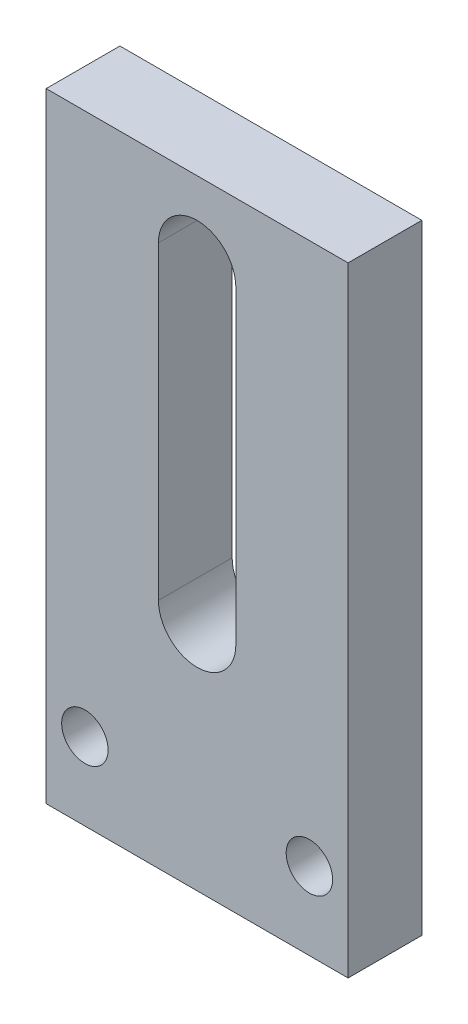
from build123d import *

# Parameters (mm, degrees)
SKETCH1_4_W         = 19.5
SKETCH1_4_H         = 40
SKETCH1_4_R         = 1.5
BOSS_EXTRUDE3_DEPTH = 4.7625


with BuildPart() as part:
    # Sketch1<4> → Boss-Extrude3 (new body)
    with BuildSketch(Plane.XY):
        with Locations((9.75, 20)):
            Rectangle(SKETCH1_4_W, SKETCH1_4_H)
        with Locations((2.5, 5)):
            Circle(SKETCH1_4_R, mode=Mode.SUBTRACT)
        with Locations((17, 5)):
            Circle(SKETCH1_4_R, mode=Mode.SUBTRACT)
        with BuildLine():
            ThreePointArc((12.25, 15), (9.749999989, 12.5), (7.25, 15.000000022))
            Line((7.25, 15.000000022), (7.25, 35))
            ThreePointArc((7.25, 35), (9.75, 37.5), (12.25, 35))
            Line((12.25, 35), (12.25, 15))
        make_face(mode=Mode.SUBTRACT)
    extrude(amount=BOSS_EXTRUDE3_DEPTH)


solid = part.part
